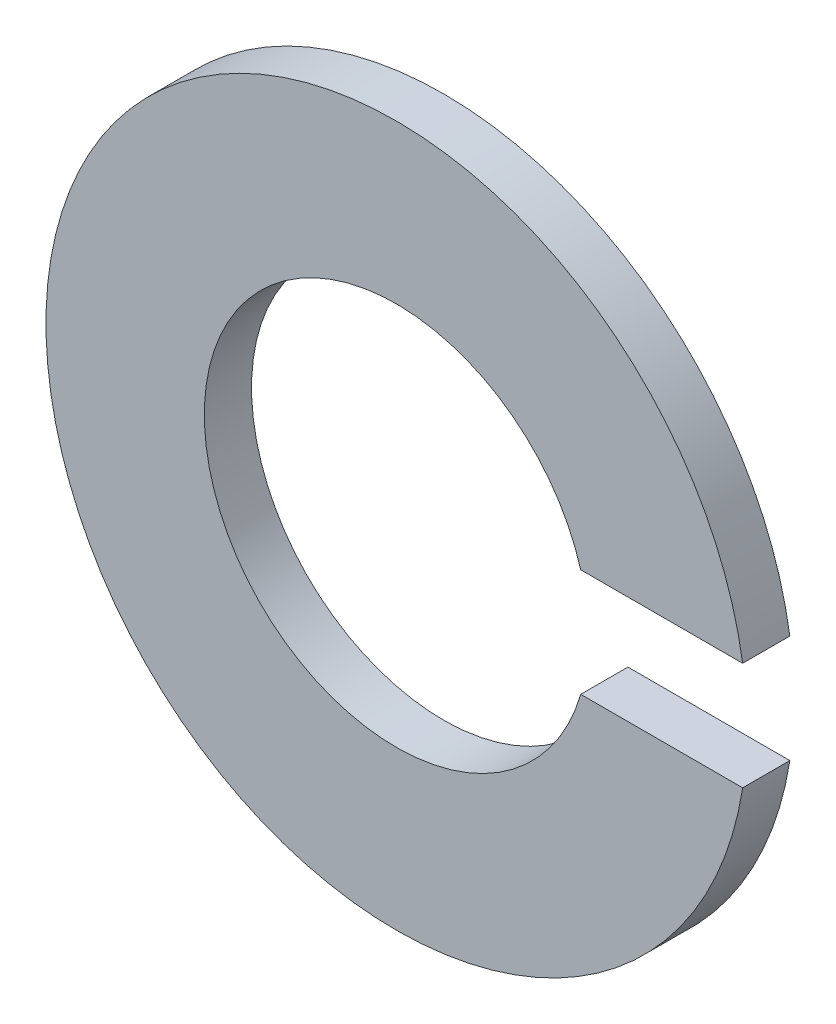
from build123d import *

# Parameters (mm, degrees)
SKETCH1_R                     = 5.2
SKETCH1_R_2                   = 2.85
INSTALLED_RING_ENVELOPE_DEPTH = 0.7
SKETCH2_W                     = 6
SKETCH2_H                     = 1.6
SPLIT_OPENING_ENVELOPE_DEPTH  = 0.71


with BuildPart() as part:
    # Sketch1 → Installed_Ring_Envelope (new body)
    with BuildSketch(Plane.XY):
        Circle(SKETCH1_R)
        Circle(SKETCH1_R_2, mode=Mode.SUBTRACT)
    extrude(amount=INSTALLED_RING_ENVELOPE_DEPTH)

    # Sketch2 → Split_Opening_Envelope (cut)
    with BuildSketch(Plane.XY.offset(0.7)):
        with Locations((3, 0)):
            Rectangle(SKETCH2_W, SKETCH2_H)
    extrude(amount=-SPLIT_OPENING_ENVELOPE_DEPTH, mode=Mode.SUBTRACT)


solid = part.part
